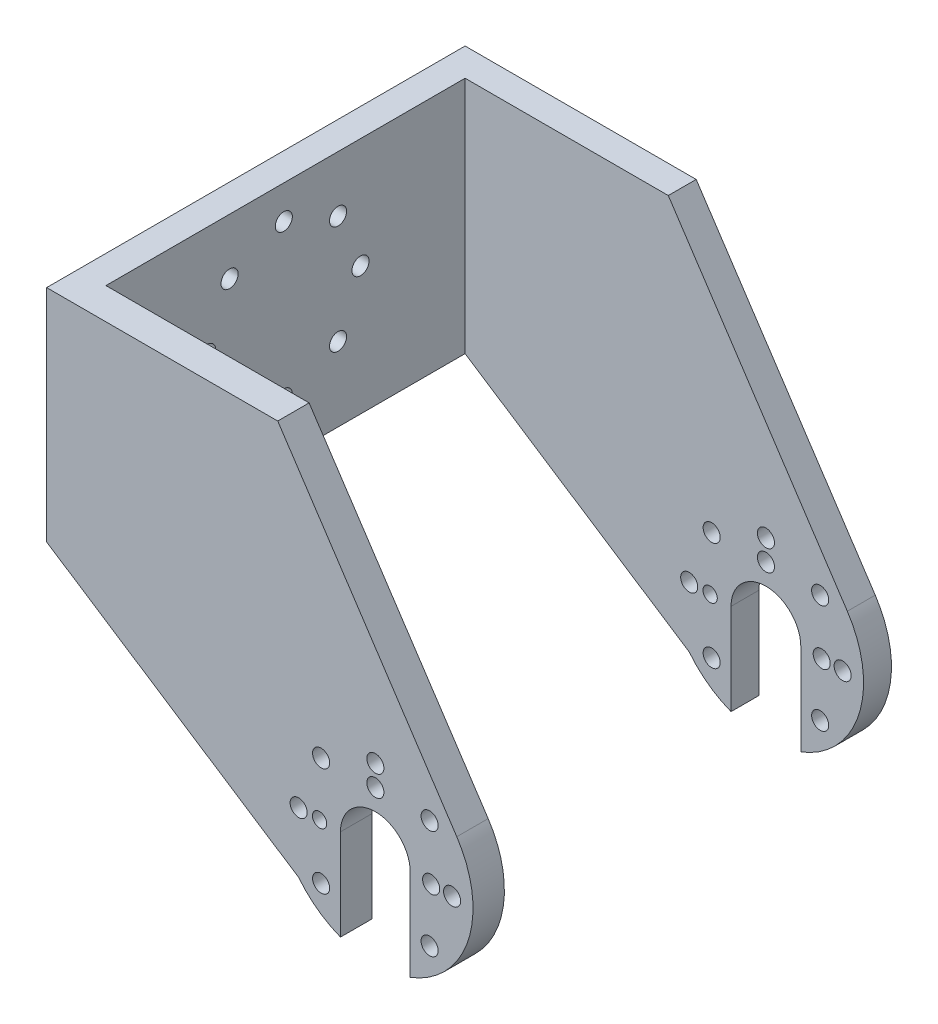
from build123d import *

# Parameters (mm, degrees)
SKETCH_1_R          = 5
SKETCH_1_R_2        = 1.225
SKETCH_1_R_3        = 1.025
EXTRUDE_1_DEPTH     = 60
SKETCH_2_W          = 57.132931415
SKETCH_2_H          = 51.5
CUT_EXTRUDE_1_DEPTH = 66
CUT_EXTRUDE_START   = -60.33903683
CUT_EXTRUDE_3_DEPTH = 60.33903683
SKETCH_8_R          = 1.225
CUT_EXTRUDE_4_DEPTH = 10


with BuildPart() as part:
    # 스케치1 → 보스-돌출1 (new body)
    with BuildSketch(Plane.XY):
        with BuildLine():
            Line((11.674013781, 7.727703555), (-14, 46.512678751))
            Line((-14, 46.512678751), (-47.132931415, 46.512678751))
            Line((-47.132931415, 46.512678751), (-47.132931415, 14.921692086))
            Line((-47.132931415, 14.921692086), (-11, -8.660254038))
            ThreePointArc((-11, -8.660254038), (8.200906179, -11.346591463), (11.674013781, 7.727703555))
        make_face()
        Circle(SKETCH_1_R, mode=Mode.SUBTRACT)
        with Locations((0, 8)):
            Circle(SKETCH_1_R_2, mode=Mode.SUBTRACT)
        with Locations((0, 11)):
            Circle(SKETCH_1_R_2, mode=Mode.SUBTRACT)
        with Locations((7.778174593, 7.778174593)):
            Circle(SKETCH_1_R_2, mode=Mode.SUBTRACT)
        with Locations((8, 0)):
            Circle(SKETCH_1_R_2, mode=Mode.SUBTRACT)
        with Locations((11, 0)):
            Circle(SKETCH_1_R_2, mode=Mode.SUBTRACT)
        with Locations((7.778174593, -7.778174593)):
            Circle(SKETCH_1_R_2, mode=Mode.SUBTRACT)
        with Locations((0, -8)):
            Circle(SKETCH_1_R_2, mode=Mode.SUBTRACT)
        with Locations((0, -11)):
            Circle(SKETCH_1_R_2, mode=Mode.SUBTRACT)
        with Locations((-7.778174593, -7.778174593)):
            Circle(SKETCH_1_R_2, mode=Mode.SUBTRACT)
        with Locations((-8, 0)):
            Circle(SKETCH_1_R_3, mode=Mode.SUBTRACT)
        with Locations((-11, 0)):
            Circle(SKETCH_1_R_2, mode=Mode.SUBTRACT)
        with Locations((-7.778174593, 7.778174593)):
            Circle(SKETCH_1_R_2, mode=Mode.SUBTRACT)
    extrude(amount=EXTRUDE_1_DEPTH)

    # 스케치2 → 컷-돌출1 (cut)
    with BuildSketch(Plane(origin=(0, 46.512678751, 0), x_dir=(1, 0, 0), z_dir=(0, 1, 0))):
        with Locations((-14.566465708, -29.75)):
            Rectangle(SKETCH_2_W, SKETCH_2_H)
    extrude(amount=-CUT_EXTRUDE_1_DEPTH, mode=Mode.SUBTRACT)

    # 스케치4 → 컷-돌출3 (cut)
    with BuildSketch(Plane.XY.offset(60).offset(CUT_EXTRUDE_START)):
        with BuildLine():
            Line((-5, 0), (-5, -13.076696831))
            ThreePointArc((-5, -13.076696831), (0, -14), (5, -13.076696831))
            Line((5, -13.076696831), (5, 0))
            Line((5, 0), (-5, 0))
        make_face()
    extrude(amount=CUT_EXTRUDE_3_DEPTH, mode=Mode.SUBTRACT)

    # 스케치8 → 컷-돌출4 (cut)
    with BuildSketch(Plane.ZY.offset(47.132931415)):
        with Locations(Location((22.217096027, 38.497340433, 0), (0, 0, 270))):
            Circle(SKETCH_8_R)
        with Locations(Location((29.99527062, 41.71916584, 0), (0, 0, 270))):
            Circle(SKETCH_8_R)
        with Locations(Location((37.773445213, 38.497340433, 0), (0, 0, 270))):
            Circle(SKETCH_8_R)
        with Locations(Location((40.99527062, 30.71916584, 0), (0, 0, 270))):
            Circle(SKETCH_8_R)
        with Locations(Location((37.773445213, 22.940991247, 0), (0, 0, 270))):
            Circle(SKETCH_8_R)
        with Locations(Location((29.99527062, 19.71916584, 0), (0, 0, 270))):
            Circle(SKETCH_8_R)
        with Locations(Location((22.217096027, 22.940991247, 0), (0, 0, 270))):
            Circle(SKETCH_8_R)
        with Locations(Location((18.99527062, 30.71916584, 0), (0, 0, 270))):
            Circle(SKETCH_8_R)
    extrude(amount=-CUT_EXTRUDE_4_DEPTH, mode=Mode.SUBTRACT)


solid = part.part
